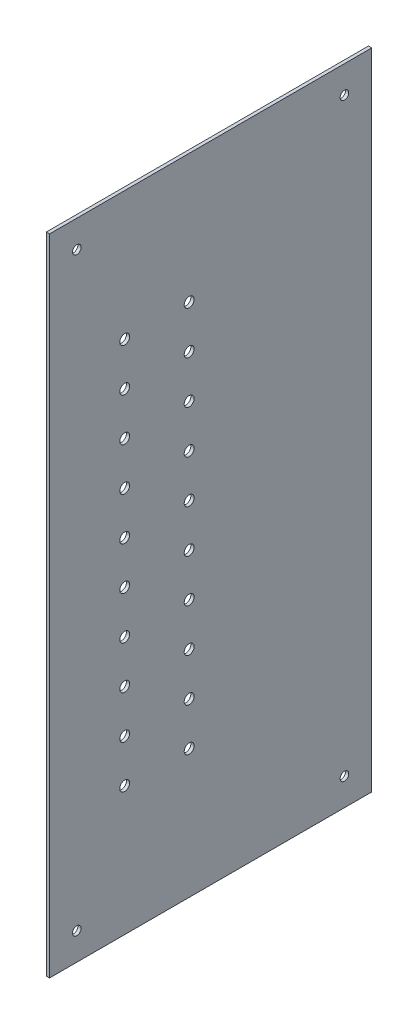
from build123d import *

# Parameters (mm, degrees)
SKETCH1_W                            = 300
SKETCH1_H                            = 150
BOSS_EXTRUDE1_DEPTH                  = 1.52
F_4_0_4_DIAMETER_HOLE1_D             = 4
MIRROR1_AT_THE_SECOND_PLANE_COPY_1_D = 4
F_4_6_4_6_DIAMETER_HOLE1_D           = 4.6
F_4_6_4_6_DIAMETER_HOLE2_D           = 4.6


with BuildPart() as part:
    # Sketch1 → Boss-Extrude1 (new body)
    with BuildSketch(Plane.YZ):
        Rectangle(SKETCH1_W, SKETCH1_H)
    extrude(amount=BOSS_EXTRUDE1_DEPTH)

    # Ø4.0 (4) Diameter Hole1 (through all)
    with Locations(Plane.YZ.offset(1.52)):
        with Locations((-137.3, 62.3)):
            f_4_0_4_diameter_hole1 = Hole(F_4_0_4_DIAMETER_HOLE1_D / 2)

    # Mirror1: Ø4.0 (4) Diameter Hole1 across plane
    add(f_4_0_4_diameter_hole1.mirror(Plane.ZX), mode=Mode.SUBTRACT)

    # Mirror1 at the second plane: Ø4.0 (4) Diameter Hole1 across plane
    add(f_4_0_4_diameter_hole1.mirror(Plane.XY), mode=Mode.SUBTRACT)

    # Mirror1 at the second plane copy 1 (through all)
    with Locations(Plane(origin=(1.52, 0, 0), x_dir=(0, -1, 0), z_dir=(1, 0, 0))):
        with Locations((-137.3, 62.3)):
            Hole(MIRROR1_AT_THE_SECOND_PLANE_COPY_1_D / 2)

    # Ø4.6 (4.6) Diameter Hole1 (through all)
    with Locations(Plane.YZ.offset(1.52)):
        with Locations((-90, 40), (-70, 40), (-50, 40), (-30, 40), (-10, 40), (10, 40), (30, 40), (50, 40), (70, 40), (90, 40)):
            Hole(F_4_6_4_6_DIAMETER_HOLE1_D / 2)

    # Ø4.6 (4.6) Diameter Hole2 (through all)
    with Locations(Plane.YZ.offset(1.52)):
        with Locations((-90, 10), (-70, 10), (-50, 10), (-30, 10), (-10, 10), (10, 10), (30, 10), (50, 10), (70, 10), (90, 10)):
            Hole(F_4_6_4_6_DIAMETER_HOLE2_D / 2)


solid = part.part
